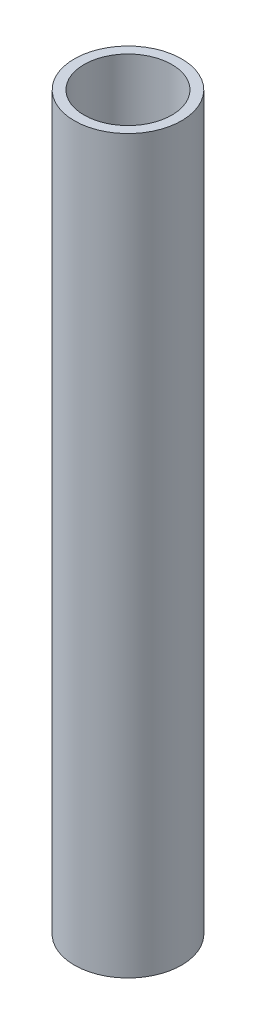
from build123d import *

# Parameters (mm, degrees)
ESQUISSE1_W = 2
ESQUISSE1_H = 150


with BuildPart() as part:
    # Esquisse1 → Base-Révolution (revolve)
    with BuildSketch(Plane.XY, mode=Mode.PRIVATE) as base_r_volution_sk:
        with Locations((10, -99)):
            Rectangle(ESQUISSE1_W, ESQUISSE1_H)
    revolve(base_r_volution_sk.sketch.rotate(Axis((0, 0, 0), (0, -1, 0)), 90), axis=Axis((0, 0, 0), (0, -1, 0)))


solid = part.part
